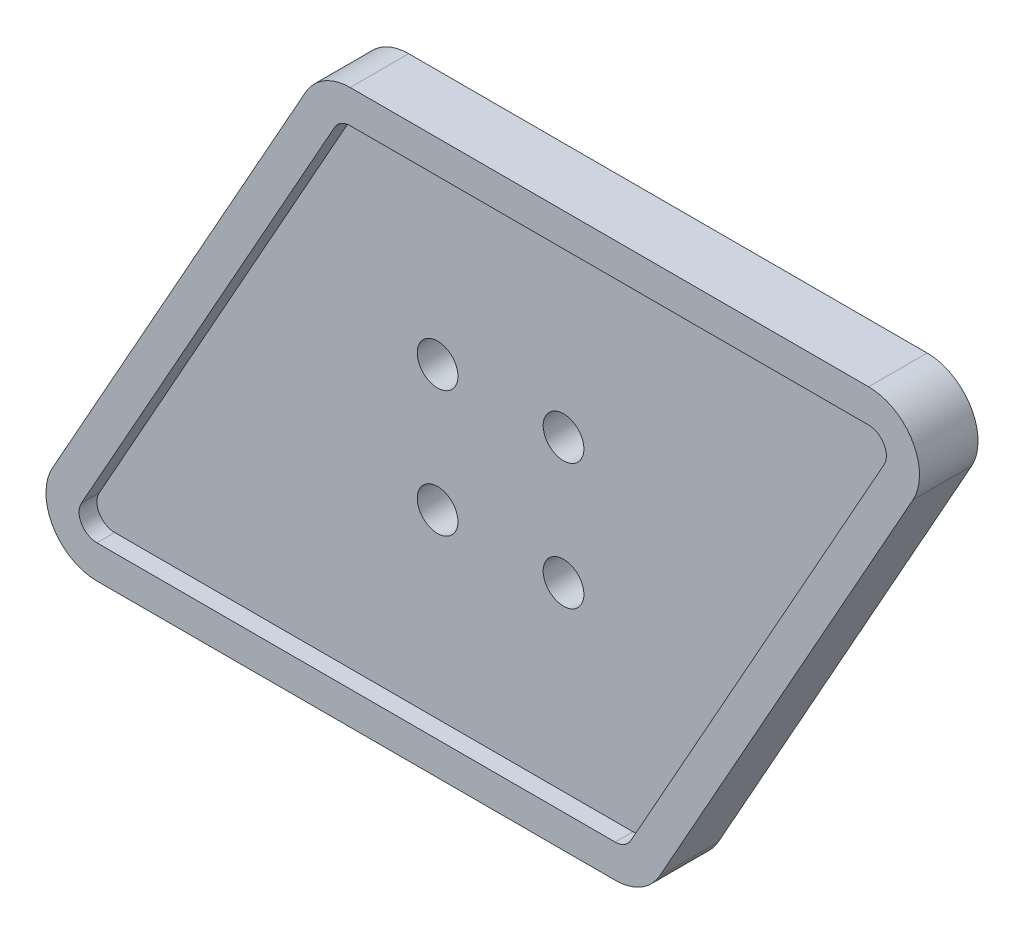
from build123d import *

# Parameters (mm, degrees)
SKETCH1_R           = 1.6
BOSS_EXTRUDE1_DEPTH = 4.6
CUT_EXTRUDE4_DEPTH  = 1.4


with BuildPart() as part:
    # Sketch1 → Boss-Extrude1 (new body)
    with BuildSketch(Plane.XY):
        with BuildLine():
            Line((-33.815617771, -15.817972293), (-13.905712582, 19.727465886))
            ThreePointArc((-13.905712582, 19.727465886), (-12.438375238, 21.223732505), (-10.415875199, 21.77271909))
            Line((-10.415875199, 21.77271909), (30.325780388, 21.77271909))
            ThreePointArc((30.325780388, 21.77271909), (33.776793804, 19.795219128), (33.815617771, 15.817972293))
            Line((33.815617771, 15.817972293), (13.905712582, -19.727465886))
            ThreePointArc((13.905712582, -19.727465886), (12.438375238, -21.223732505), (10.415875199, -21.77271909))
            Line((10.415875199, -21.77271909), (-30.325780388, -21.77271909))
            ThreePointArc((-30.325780388, -21.77271909), (-33.776793804, -19.795219128), (-33.815617771, -15.817972293))
        make_face()
        with Locations((-4.949747468, 4.949747468)):
            Circle(SKETCH1_R, mode=Mode.SUBTRACT)
        with Locations((4.949747468, 4.949747468)):
            Circle(SKETCH1_R, mode=Mode.SUBTRACT)
        with Locations((4.949747468, -4.949747468)):
            Circle(SKETCH1_R, mode=Mode.SUBTRACT)
        with Locations((-4.949747468, -4.949747468)):
            Circle(SKETCH1_R, mode=Mode.SUBTRACT)
    extrude(amount=BOSS_EXTRUDE1_DEPTH)

    # Sketch5 → Cut-Extrude4 (cut)
    with BuildSketch(Plane.XY.offset(4.6)):
        with BuildLine():
            Line((11.637318283, -18.456880469), (31.547223472, 17.088557711))
            ThreePointArc((31.547223472, 17.088557711), (31.533635084, 18.480594103), (30.325780388, 19.17271909))
            Line((30.325780388, 19.17271909), (-10.415875199, 19.17271909))
            ThreePointArc((-10.415875199, 19.17271909), (-11.123750213, 18.980573785), (-11.637318283, 18.456880469))
            Line((-11.637318283, 18.456880469), (-31.547223472, -17.088557711))
            ThreePointArc((-31.547223472, -17.088557711), (-31.533635084, -18.480594103), (-30.325780388, -19.17271909))
            Line((-30.325780388, -19.17271909), (10.415875199, -19.17271909))
            ThreePointArc((10.415875199, -19.17271909), (11.123750213, -18.980573785), (11.637318283, -18.456880469))
        make_face()
    extrude(amount=-CUT_EXTRUDE4_DEPTH, mode=Mode.SUBTRACT)


solid = part.part
